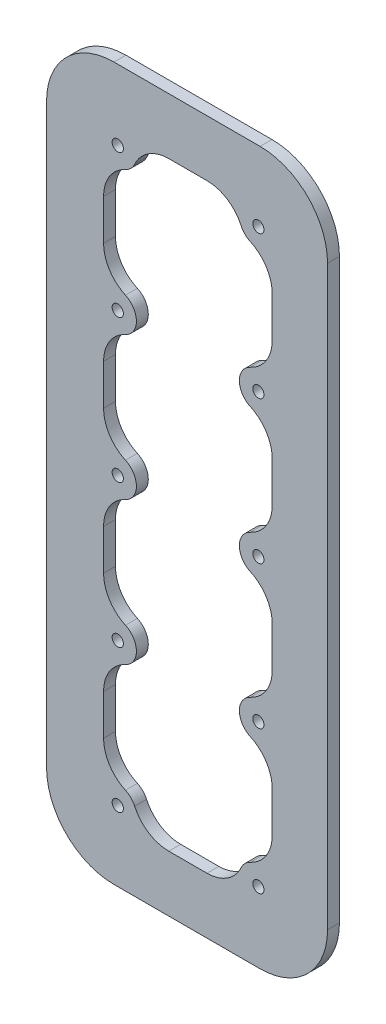
from build123d import *

# Parameters (mm, degrees)
BOSS_EXTRUDE1_DEPTH = 3.175
SKETCH2_R           = 1.5
CUT_EXTRUDE1_DEPTH  = 127.329037605
FILLET1_R           = 10


with BuildPart() as part:
    # Sketch1 → Boss-Extrude1 (new body)
    with BuildSketch(Plane.XY):
        with BuildLine():
            Line((-5.907287394, -79.006942124), (-5.907287394, 74.993057876))
            add(Edge.make_bspline(
                [(-5.907287394, 74.993057876), (-5.907287394, 92.993057876), (-23.89632228, 92.993057876)],
                knots=[4.71238898, 4.71238898, 4.71238898, 6.283185307, 6.283185307, 6.283185307], degree=2, weights=[1, 0.707106781, 1]))
            Line((-23.89632228, 92.993057876), (-62.872564534, 92.993057876))
            add(Edge.make_bspline(
                [(-62.872564534, 92.993057876), (-80.86159942, 92.993057876), (-80.86159942, 74.993057876)],
                knots=[0, 0, 0, 1.570796327, 1.570796327, 1.570796327], degree=2, weights=[1, 0.707106781, 1]))
            Line((-80.86159942, 74.993057876), (-80.86159942, -79.006942124))
            add(Edge.make_bspline(
                [(-80.86159942, -79.006942124), (-80.86159942, -97.006942124), (-62.872564534, -97.006942124)],
                knots=[1.570796327, 1.570796327, 1.570796327, 3.141592654, 3.141592654, 3.141592654], degree=2, weights=[1, 0.707106781, 1]))
            Line((-62.872564534, -97.006942124), (-23.89632228, -97.006942124))
            add(Edge.make_bspline(
                [(-23.89632228, -97.006942124), (-5.907287394, -97.006942124), (-5.907287394, -79.006942124)],
                knots=[0, 0, 0, 1.570796327, 1.570796327, 1.570796327], degree=2, weights=[1, 0.707106781, 1]))
        make_face()
    extrude(amount=BOSS_EXTRUDE1_DEPTH)

    # Sketch2 → Cut-Extrude1 (cut, through all)
    with BuildSketch(Plane.XY.offset(3.175)):
        with Locations((-61.861304112, 74.235698563)):
            Circle(SKETCH2_R)
        with Locations((-24.353173798, 74.235698563)):
            Circle(SKETCH2_R)
        with Locations((-24.353173798, 36.114378219)):
            Circle(SKETCH2_R)
        with Locations((-24.353173798, -2.006942124)):
            Circle(SKETCH2_R)
        with Locations((-24.353173798, -40.128262468)):
            Circle(SKETCH2_R)
        with Locations((-61.861304112, -40.128262468)):
            Circle(SKETCH2_R)
        with Locations((-61.861304112, -2.006942124)):
            Circle(SKETCH2_R)
        with Locations((-61.861304112, 36.114378219)):
            Circle(SKETCH2_R)
        with Locations((-24.353173798, -78.249582811)):
            Circle(SKETCH2_R)
        with Locations((-61.861304112, -78.249582811)):
            Circle(SKETCH2_R)
        with BuildLine():
            Line((-20.676537995, 41.114378219), (-20.676537995, 69.235698563))
            Line((-20.676537995, 69.235698563), (-24.431608426, 69.235698563))
            add(Edge.make_bspline(
                [(-29.428562561, 74.235698563), (-29.428562561, 69.235698563), (-24.431608426, 69.235698563)],
                knots=[1.570796327, 1.570796327, 1.570796327, 3.141592654, 3.141592654, 3.141592654], degree=2, weights=[1, 0.707106781, 1]))
            Line((-29.428562561, 74.235698563), (-29.650174365, 77.993057876))
            Line((-29.650174365, 77.993057876), (-56.897100644, 77.993057876))
            Line((-56.897100644, 77.993057876), (-56.897100644, 74.235698563))
            add(Edge.make_bspline(
                [(-61.89405478, 69.235698563), (-56.897100644, 69.235698563), (-56.897100644, 74.235698563)],
                knots=[0, 0, 0, 1.570796327, 1.570796327, 1.570796327], degree=2, weights=[1, 0.707106781, 1]))
            Line((-61.89405478, 69.235698563), (-65.649125211, 69.235698563))
            Line((-65.649125211, 69.235698563), (-65.649125211, 41.114378219))
            Line((-65.649125211, 41.114378219), (-61.89405478, 41.114378219))
            add(Edge.make_bspline(
                [(-61.89405478, 31.114378219), (-56.897100644, 31.114378219), (-56.897100644, 36.114378219), (-56.897100644, 41.114378219), (-61.89405478, 41.114378219)],
                knots=[0, 0, 0, 1.570796327, 1.570796327, 3.141592654, 3.141592654, 3.141592654], degree=2, weights=[1, 0.707106781, 1, 0.707106781, 1]))
            Line((-61.89405478, 31.114378219), (-65.649125211, 31.114378219))
            Line((-65.649125211, 31.114378219), (-65.649125211, 2.993057876))
            Line((-65.649125211, 2.993057876), (-61.89405478, 2.993057876))
            add(Edge.make_bspline(
                [(-61.89405478, -7.006942124), (-56.897100644, -7.006942124), (-56.897100644, -2.006942124), (-56.897100644, 2.993057876), (-61.89405478, 2.993057876)],
                knots=[0, 0, 0, 1.570796327, 1.570796327, 3.141592654, 3.141592654, 3.141592654], degree=2, weights=[1, 0.707106781, 1, 0.707106781, 1]))
            Line((-61.89405478, -7.006942124), (-65.649125211, -7.006942124))
            Line((-65.649125211, -7.006942124), (-65.649125211, -35.128262468))
            Line((-65.649125211, -35.128262468), (-61.89405478, -35.128262468))
            add(Edge.make_bspline(
                [(-61.89405478, -45.128262468), (-56.897100644, -45.128262468), (-56.897100644, -40.128262468), (-56.897100644, -35.128262468), (-61.89405478, -35.128262468)],
                knots=[0, 0, 0, 1.570796327, 1.570796327, 3.141592654, 3.141592654, 3.141592654], degree=2, weights=[1, 0.707106781, 1, 0.707106781, 1]))
            Line((-61.89405478, -45.128262468), (-65.649125211, -45.128262468))
            Line((-65.649125211, -45.128262468), (-65.649125211, -73.249582811))
            Line((-65.649125211, -73.249582811), (-61.89405478, -73.249582811))
            add(Edge.make_bspline(
                [(-56.897100644, -78.249582811), (-56.897100644, -73.249582811), (-61.89405478, -73.249582811)],
                knots=[1.570796327, 1.570796327, 1.570796327, 3.141592654, 3.141592654, 3.141592654], degree=2, weights=[1, 0.707106781, 1]))
            Line((-56.897100644, -78.249582811), (-56.897100644, -82.006942124))
            Line((-56.897100644, -82.006942124), (-29.650174365, -82.006942124))
            Line((-29.650174365, -82.006942124), (-29.428562561, -78.249582811))
            add(Edge.make_bspline(
                [(-24.431608426, -73.249582811), (-29.428562561, -73.249582811), (-29.428562561, -78.249582811)],
                knots=[0, 0, 0, 1.570796327, 1.570796327, 1.570796327], degree=2, weights=[1, 0.707106781, 1]))
            Line((-24.431608426, -73.249582811), (-20.676537995, -73.249582811))
            Line((-20.676537995, -73.249582811), (-20.676537995, -45.128262468))
            Line((-20.676537995, -45.128262468), (-24.431608426, -45.128262468))
            add(Edge.make_bspline(
                [(-24.431608426, -35.128262468), (-29.428562561, -35.128262468), (-29.428562561, -40.128262468), (-29.428562561, -45.128262468), (-24.431608426, -45.128262468)],
                knots=[0, 0, 0, 1.570796327, 1.570796327, 3.141592654, 3.141592654, 3.141592654], degree=2, weights=[1, 0.707106781, 1, 0.707106781, 1]))
            Line((-24.431608426, -35.128262468), (-20.676537995, -35.128262468))
            Line((-20.676537995, -35.128262468), (-20.676537995, -7.006942124))
            Line((-20.676537995, -7.006942124), (-24.431608426, -7.006942124))
            add(Edge.make_bspline(
                [(-24.431608426, 2.993057876), (-29.428562561, 2.993057876), (-29.428562561, -2.006942124), (-29.428562561, -7.006942124), (-24.431608426, -7.006942124)],
                knots=[3.141592654, 3.141592654, 3.141592654, 4.71238898, 4.71238898, 6.283185307, 6.283185307, 6.283185307], degree=2, weights=[1, 0.707106781, 1, 0.707106781, 1]))
            Line((-24.431608426, 2.993057876), (-20.676537995, 2.993057876))
            Line((-20.676537995, 2.993057876), (-20.676537995, 31.114378219))
            Line((-20.676537995, 31.114378219), (-24.431608426, 31.114378219))
            add(Edge.make_bspline(
                [(-24.431608426, 41.114378219), (-29.428562561, 41.114378219), (-29.428562561, 36.114378219), (-29.428562561, 31.114378219), (-24.431608426, 31.114378219)],
                knots=[0, 0, 0, 1.570796327, 1.570796327, 3.141592654, 3.141592654, 3.141592654], degree=2, weights=[1, 0.707106781, 1, 0.707106781, 1]))
            Line((-24.431608426, 41.114378219), (-20.676537995, 41.114378219))
        make_face()
    extrude(amount=-CUT_EXTRUDE1_DEPTH, mode=Mode.SUBTRACT)

    # Fillet1
    fillet1_edges = [part.edges().sort_by_distance(p)[0] for p in [
        (-20.676537995, 41.114378219, 1.5875),
        (-20.676537995, 2.993057876, 1.5875),
        (-20.676537995, -35.128262468, 1.5875),
        (-29.650174365, -82.006942124, 1.5875),
        (-20.676537995, -73.249582811, 1.5875),
        (-20.676537995, -7.006942124, 1.5875),
        (-20.676537995, -45.128262468, 1.5875),
        (-20.676537995, 31.114378219, 1.5875),
        (-20.676537995, 69.235698563, 1.5875),
        (-29.650174365, 77.993057876, 1.5875),
        (-65.649125211, 41.114378219, 1.5875),
        (-65.649125211, 2.993057876, 1.5875),
        (-65.649125211, -35.128262468, 1.5875),
        (-56.897100644, -82.006942124, 1.5875),
        (-65.649125211, -73.249582811, 1.5875),
        (-65.649125211, -7.006942124, 1.5875),
        (-65.649125211, -45.128262468, 1.5875),
        (-65.649125211, 31.114378219, 1.5875),
        (-56.897100644, 77.993057876, 1.5875),
        (-65.649125211, 69.235698563, 1.5875),
    ]]
    fillet(fillet1_edges, radius=FILLET1_R)


solid = part.part
